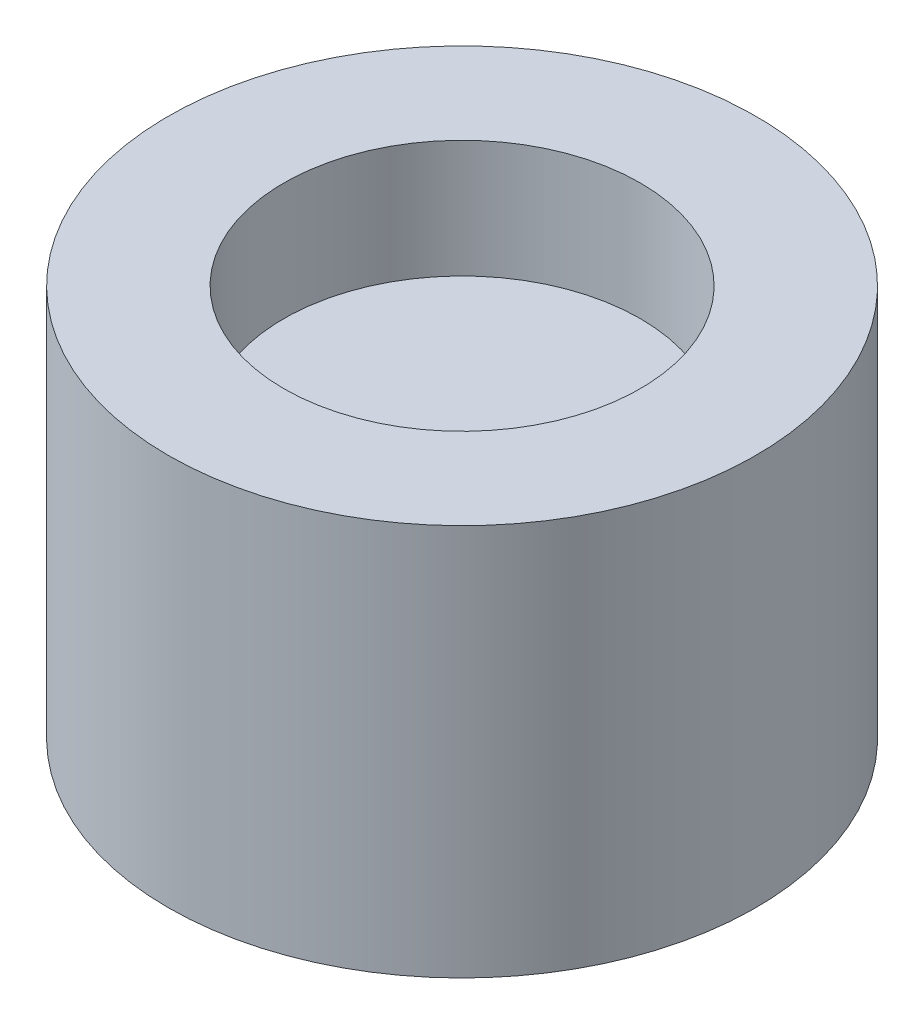
from build123d import *

# Parameters (mm, degrees)
SKETCH1_R           = 7.5
BOSS_EXTRUDE2_DEPTH = 10
SKETCH3_R           = 4.55
CUT_EXTRUDE1_DEPTH  = 3


with BuildPart() as part:
    # Sketch1 → Boss-Extrude2 (new body)
    with BuildSketch(Plane(origin=(0, 0, 0), x_dir=(1, 0, 0), z_dir=(0, 1, 0))):
        with Locations(Location((0, 0, 0), (0, 0, 270))):
            Circle(SKETCH1_R)
    extrude(amount=BOSS_EXTRUDE2_DEPTH)

    # Sketch3 → Cut-Extrude1 (cut)
    with BuildSketch(Plane(origin=(0, 10, 0), x_dir=(1, 0, 0), z_dir=(0, 1, 0))):
        with Locations(Location((0, 0, 0), (0, 0, 270))):
            Circle(SKETCH3_R)
    extrude(amount=-CUT_EXTRUDE1_DEPTH, mode=Mode.SUBTRACT)


solid = part.part
